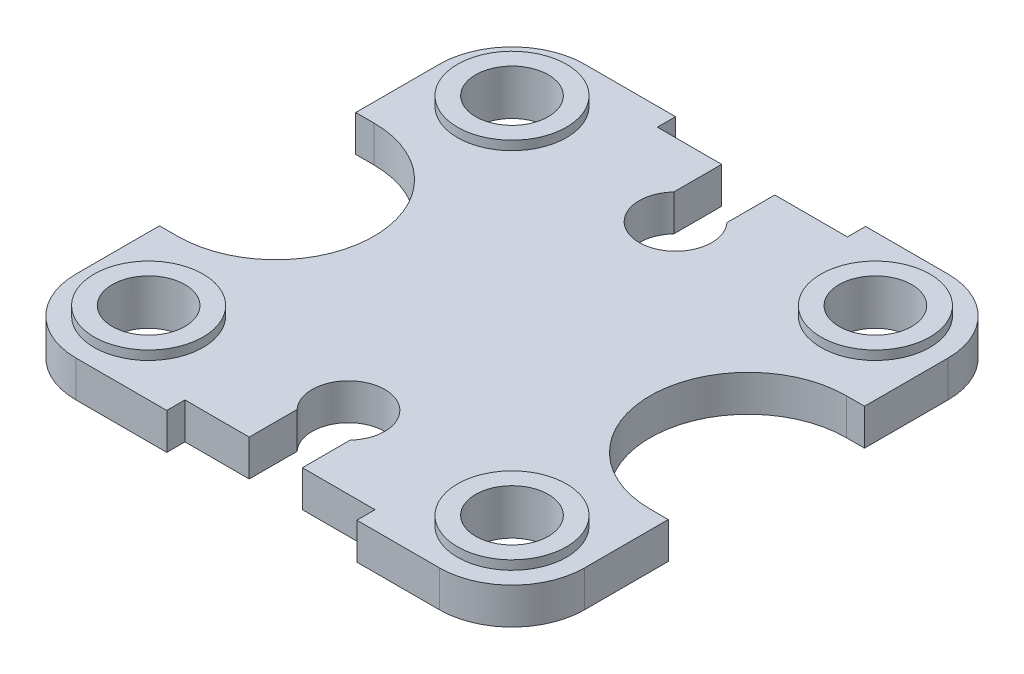
from build123d import *

# Parameters (mm, degrees)
SKETCH2_R           = 20
BOSS_EXTRUDE1_DEPTH = 20
SKETCH3_R           = 30
SKETCH3_R_2         = 20
BOSS_EXTRUDE2_DEPTH = 5


with BuildPart() as part:
    # Sketch2 → Boss-Extrude1 (new body)
    with BuildSketch(Plane(origin=(0, 0, 0), x_dir=(1, 0, 0), z_dir=(0, 1, 0))):
        with BuildLine():
            Line((-14.611492378, -130), (-14.611492378, -103.656657369))
            ThreePointArc((-14.611492378, -103.656657369), (0, -70), (14.611492378, -103.656657369))
            Line((14.611492378, -103.656657369), (14.611492378, -130))
            Line((14.611492378, -130), (54.611492378, -130))
            Line((54.611492378, -130), (54.611492378, -140))
            Line((54.611492378, -140), (100, -140))
            ThreePointArc((100, -140), (128.284271247, -128.284271247), (140, -100))
            Line((140, -100), (140, -54))
            Line((140, -54), (130, -54))
            ThreePointArc((130, -54), (76, 0), (130, 54))
            Line((130, 54), (140, 54))
            Line((140, 54), (140, 100))
            ThreePointArc((140, 100), (128.284271247, 128.284271247), (100, 140))
            Line((100, 140), (54.611492378, 140))
            Line((54.611492378, 140), (54.611492378, 130))
            Line((54.611492378, 130), (14.611492378, 130))
            Line((14.611492378, 130), (14.611492378, 103.656657369))
            ThreePointArc((14.611492378, 103.656657369), (0, 70), (-14.611492378, 103.656657369))
            Line((-14.611492378, 103.656657369), (-14.611492378, 130))
            Line((-14.611492378, 130), (-50, 130))
            Line((-50, 130), (-50, 140))
            Line((-50, 140), (-100, 140))
            ThreePointArc((-100, 140), (-128.284271247, 128.284271247), (-140, 100))
            Line((-140, 100), (-140, 54))
            Line((-140, 54), (-130, 54))
            ThreePointArc((-130, 54), (-76, 0), (-130, -54))
            Line((-130, -54), (-140, -54))
            Line((-140, -54), (-140, -100))
            ThreePointArc((-140, -100), (-128.284271247, -128.284271247), (-100, -140))
            Line((-100, -140), (-50, -140))
            Line((-50, -140), (-50, -130))
            Line((-50, -130), (-14.611492378, -130))
        make_face()
        with Locations(Location((-100, -100, 0), (0, 0, 270))):
            Circle(SKETCH2_R, mode=Mode.SUBTRACT)
        with Locations(Location((-100, 100, 0), (0, 0, 270))):
            Circle(SKETCH2_R, mode=Mode.SUBTRACT)
        with Locations(Location((100, 100, 0), (0, 0, 270))):
            Circle(SKETCH2_R, mode=Mode.SUBTRACT)
        with Locations(Location((100, -100, 0), (0, 0, 270))):
            Circle(SKETCH2_R, mode=Mode.SUBTRACT)
    extrude(amount=BOSS_EXTRUDE1_DEPTH)

    # Sketch3 → Boss-Extrude2 (add)
    # profile 1 of 4: a face of its own
    with BuildSketch(Plane(origin=(0, 20, 0), x_dir=(1, 0, 0), z_dir=(0, 1, 0))):
        with Locations(Location((-100, 100, 0), (0, 0, 270))):
            Circle(SKETCH3_R)
        with Locations(Location((-100, 100, 0), (0, 0, 270))):
            Circle(SKETCH3_R_2, mode=Mode.SUBTRACT)
    # profile 2 of 4: a face of its own
    with BuildSketch(Plane(origin=(0, 20, 0), x_dir=(1, 0, 0), z_dir=(0, 1, 0))):
        with Locations(Location((100, 100, 0), (0, 0, 90))):
            Circle(SKETCH3_R)
        with Locations(Location((100, 100, 0), (0, 0, 90))):
            Circle(SKETCH3_R_2, mode=Mode.SUBTRACT)
    # profile 3 of 4: a face of its own
    with BuildSketch(Plane(origin=(0, 20, 0), x_dir=(1, 0, 0), z_dir=(0, 1, 0))):
        with Locations(Location((100, -100, 0), (0, 0, 270))):
            Circle(SKETCH3_R)
        with Locations(Location((100, -100, 0), (0, 0, 270))):
            Circle(SKETCH3_R_2, mode=Mode.SUBTRACT)
    # profile 4 of 4: a face of its own
    with BuildSketch(Plane(origin=(0, 20, 0), x_dir=(1, 0, 0), z_dir=(0, 1, 0))):
        with Locations(Location((-100, -100, 0), (0, 0, 90))):
            Circle(SKETCH3_R)
        with Locations(Location((-100, -100, 0), (0, 0, 90))):
            Circle(SKETCH3_R_2, mode=Mode.SUBTRACT)
    extrude(amount=BOSS_EXTRUDE2_DEPTH)


solid = part.part
